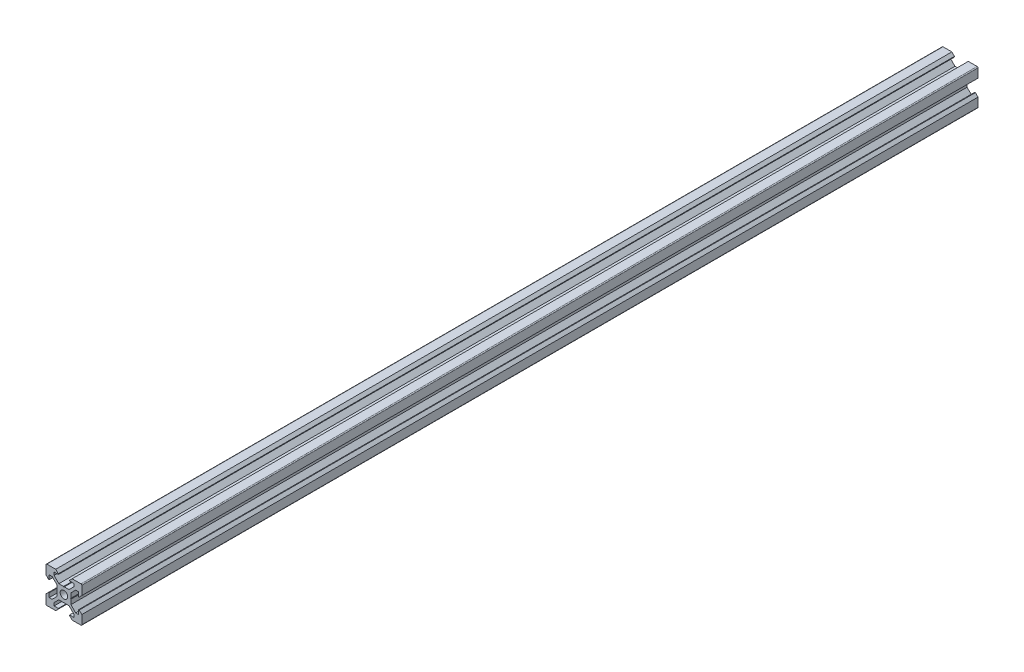
from build123d import *

# Parameters (mm, degrees)
SKETCH1_R           = 2.1
BOSS_EXTRUDE1_DEPTH = 500


with BuildPart() as part:
    # Sketch1 → Boss-Extrude1 (new body)
    with BuildSketch(Plane(origin=(0, 0, 0), x_dir=(-1, 0, 0), z_dir=(0, 0, -1))):
        with BuildLine():
            Line((-3.69, 0), (-3.9, -0.21))
            Line((-3.9, -0.21), (-3.9, -2.839339828))
            Line((-3.9, -2.839339828), (-6.560660172, -5.5))
            Line((-6.560660172, -5.5), (-8.2, -5.5))
            Line((-8.2, -5.5), (-8.2, -3.125))
            Line((-8.2, -3.125), (-8.545, -3.125))
            Line((-8.545, -3.125), (-10, -4.58))
            Line((-10, -4.58), (-10, -9.5))
            ThreePointArc((-10, -9.5), (-9.853553391, -9.853553391), (-9.5, -10))
            Line((-9.5, -10), (-4.58, -10))
            Line((-4.58, -10), (-3.125, -8.545))
            Line((-3.125, -8.545), (-3.125, -8.2))
            Line((-3.125, -8.2), (-5.5, -8.2))
            Line((-5.5, -8.2), (-5.5, -6.560660172))
            Line((-5.5, -6.560660172), (-2.839339828, -3.9))
            Line((-2.839339828, -3.9), (-0.21, -3.9))
            Line((-0.21, -3.9), (0, -3.69))
            Line((0, -3.69), (0.21, -3.9))
            Line((0.21, -3.9), (2.839339828, -3.9))
            Line((2.839339828, -3.9), (5.5, -6.560660172))
            Line((5.5, -6.560660172), (5.5, -8.2))
            Line((5.5, -8.2), (3.125, -8.2))
            Line((3.125, -8.2), (3.125, -8.545))
            Line((3.125, -8.545), (4.58, -10))
            Line((4.58, -10), (9.5, -10))
            ThreePointArc((9.5, -10), (9.853553391, -9.853553391), (10, -9.5))
            Line((10, -9.5), (10, -4.58))
            Line((10, -4.58), (8.545, -3.125))
            Line((8.545, -3.125), (8.2, -3.125))
            Line((8.2, -3.125), (8.2, -5.5))
            Line((8.2, -5.5), (6.560660172, -5.5))
            Line((6.560660172, -5.5), (3.9, -2.839339828))
            Line((3.9, -2.839339828), (3.9, -0.21))
            Line((3.9, -0.21), (3.69, 0))
            Line((3.69, 0), (3.9, 0.21))
            Line((3.9, 0.21), (3.9, 2.839339828))
            Line((3.9, 2.839339828), (6.560660172, 5.5))
            Line((6.560660172, 5.5), (8.2, 5.5))
            Line((8.2, 5.5), (8.2, 3.125))
            Line((8.2, 3.125), (8.545, 3.125))
            Line((8.545, 3.125), (10, 4.58))
            Line((10, 4.58), (10, 9.5))
            ThreePointArc((10, 9.5), (9.853553391, 9.853553391), (9.5, 10))
            Line((9.5, 10), (4.58, 10))
            Line((4.58, 10), (3.125, 8.545))
            Line((3.125, 8.545), (3.125, 8.2))
            Line((3.125, 8.2), (5.5, 8.2))
            Line((5.5, 8.2), (5.5, 6.560660172))
            Line((5.5, 6.560660172), (2.839339828, 3.9))
            Line((2.839339828, 3.9), (0.21, 3.9))
            Line((0.21, 3.9), (0, 3.69))
            Line((0, 3.69), (-0.21, 3.9))
            Line((-0.21, 3.9), (-2.839339828, 3.9))
            Line((-2.839339828, 3.9), (-5.5, 6.560660172))
            Line((-5.5, 6.560660172), (-5.5, 8.2))
            Line((-5.5, 8.2), (-3.125, 8.2))
            Line((-3.125, 8.2), (-3.125, 8.545))
            Line((-3.125, 8.545), (-4.58, 10))
            Line((-4.58, 10), (-9.5, 10))
            ThreePointArc((-9.5, 10), (-9.853553391, 9.853553391), (-10, 9.5))
            Line((-10, 9.5), (-10, 4.58))
            Line((-10, 4.58), (-8.545, 3.125))
            Line((-8.545, 3.125), (-8.2, 3.125))
            Line((-8.2, 3.125), (-8.2, 5.5))
            Line((-8.2, 5.5), (-6.560660172, 5.5))
            Line((-6.560660172, 5.5), (-3.9, 2.839339828))
            Line((-3.9, 2.839339828), (-3.9, 0.21))
            Line((-3.9, 0.21), (-3.69, 0))
        make_face()
        with Locations(Location((0, 0, 0), (0, 0, 180))):
            Circle(SKETCH1_R, mode=Mode.SUBTRACT)
    extrude(amount=-BOSS_EXTRUDE1_DEPTH)


solid = part.part
